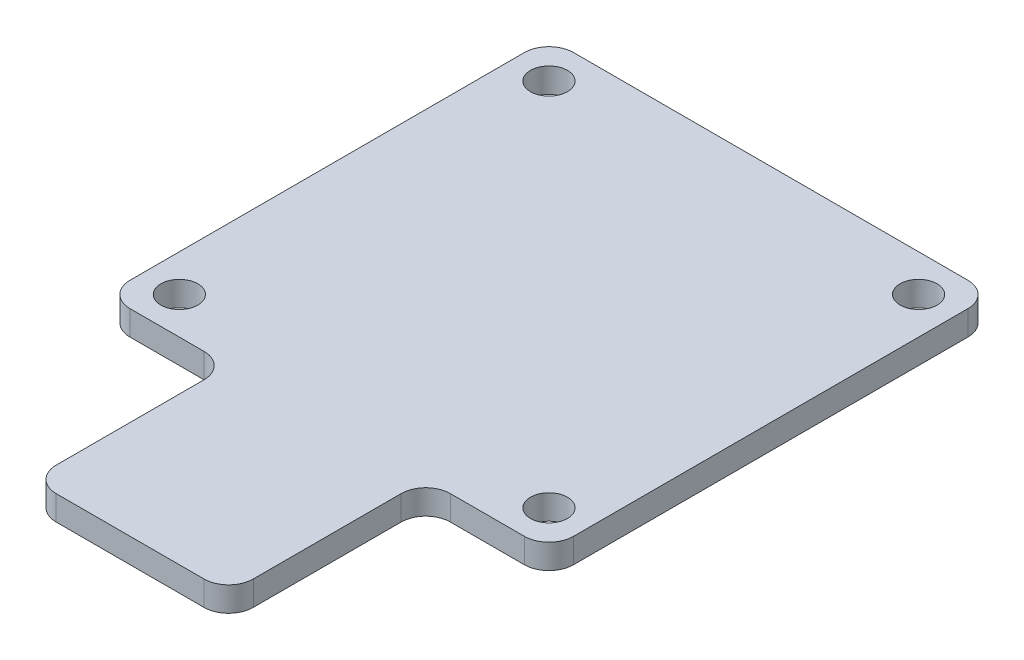
from build123d import *

# Parameters (mm, degrees)
SKETCH1_R           = 1.5
BOSS_EXTRUDE1_DEPTH = 2
FILLET1_R           = 2


with BuildPart() as part:
    # Sketch1 → Boss-Extrude1 (new body)
    with BuildSketch(Plane(origin=(0, 0, 0), x_dir=(1, 0, 0), z_dir=(0, 1, 0))):
        Polygon((-18, 18), (18, 18), (18, -18), (8, -18), (8, -34), (-8, -34), (-8, -18), (-18, -18), align=None)
        with Locations(Location((-15, 15, 0), (0, 0, 270))):
            Circle(SKETCH1_R, mode=Mode.SUBTRACT)
        with Locations(Location((15, 15, 0), (0, 0, 90))):
            Circle(SKETCH1_R, mode=Mode.SUBTRACT)
        with Locations(Location((15, -15, 0), (0, 0, 270))):
            Circle(SKETCH1_R, mode=Mode.SUBTRACT)
        with Locations(Location((-15, -15, 0), (0, 0, 90))):
            Circle(SKETCH1_R, mode=Mode.SUBTRACT)
    extrude(amount=BOSS_EXTRUDE1_DEPTH)

    # Fillet1
    fillet1_edges = [part.edges().sort_by_distance(p)[0] for p in [
        (8, 1, 18),
        (8, 1, 34),
        (-8, 1, 34),
        (-8, 1, 18),
        (-18, 1, 18),
        (-18, 1, -18),
        (18, 1, -18),
        (18, 1, 18),
    ]]
    fillet(fillet1_edges, radius=FILLET1_R)


solid = part.part
